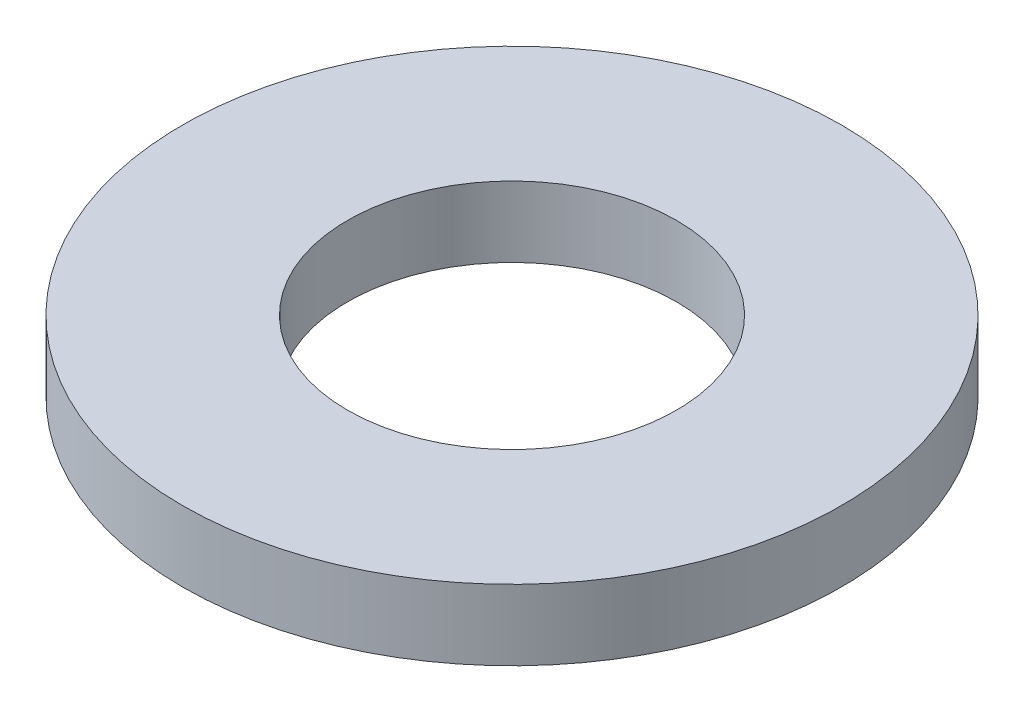
from build123d import *

# Parameters (mm, degrees)
SKETCH1_R            = 4.5085
BOSS_EXTRUDE1_DEPTH  = 0.9652
M4_CLEARANCE_HOLE1_D = 4.5


with BuildPart() as part:
    # Sketch1 → Boss-Extrude1 (new body)
    with BuildSketch(Plane(origin=(0, 0, 0), x_dir=(1, 0, 0), z_dir=(0, 1, 0))):
        with Locations(Location((0, 0, 0), (0, 0, 90))):
            Circle(SKETCH1_R)
    extrude(amount=BOSS_EXTRUDE1_DEPTH)

    # M4 Clearance Hole1 (through all)
    with Locations(Plane(origin=(0, 0.9652, 0), x_dir=(1, 0, 0), z_dir=(0, 1, 0))):
        with Locations((0, 0)):
            Hole(M4_CLEARANCE_HOLE1_D / 2)


solid = part.part
